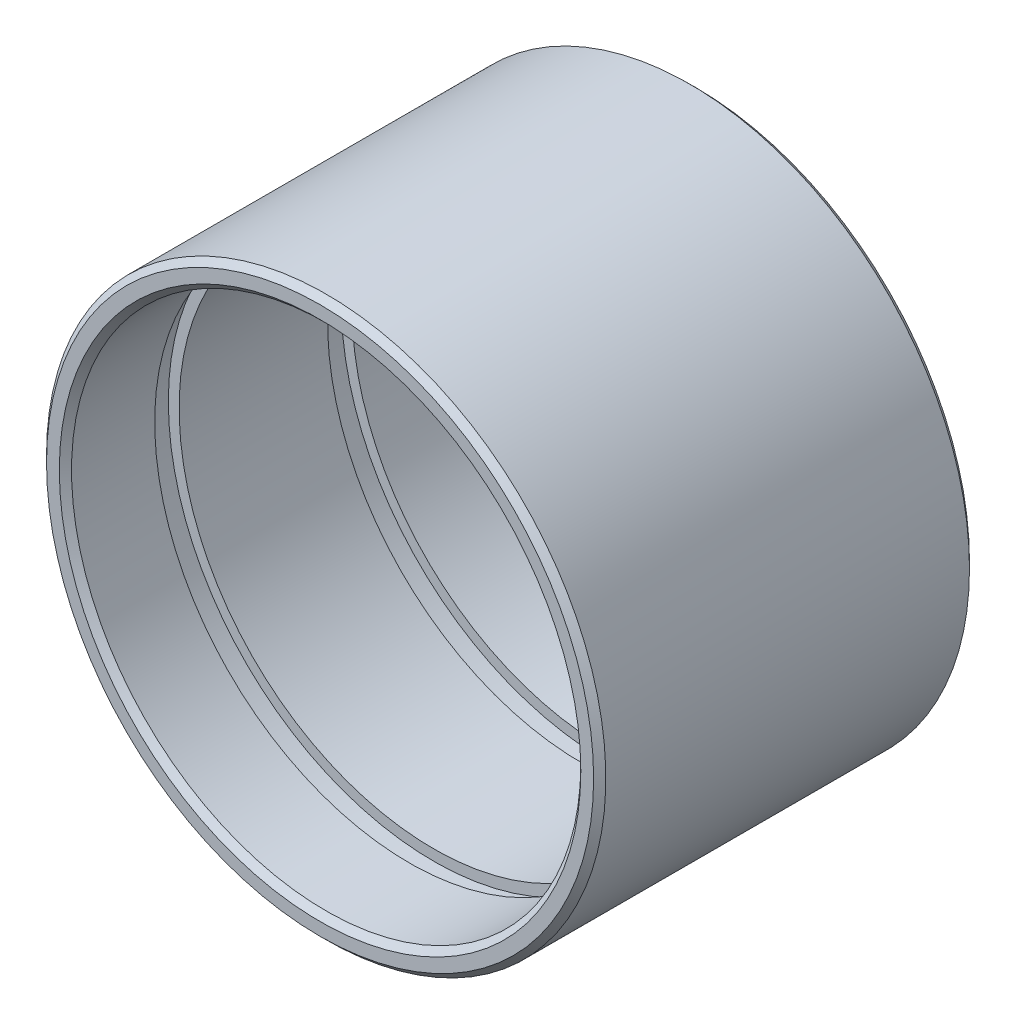
from build123d import *

# Parameters (mm, degrees)
SKETCH1_R          = 17.4625
SKETCH1_R_2        = 15.9004
BASE_EXTRUDE_DEPTH = 23.4696
SKETCH2_R          = 16.5735
CUT_EXTRUDE1_DEPTH = 1.524
CUT_EXTRUDE2_START = 1.524
SKETCH3_R          = 16.5735
CUT_EXTRUDE2_DEPTH = 1.524
CHAMFER1_SIZE      = 0.381


with BuildPart() as part:
    # Sketch1 → Base-Extrude (new body)
    with BuildSketch(Plane.XY):
        Circle(SKETCH1_R)
        Circle(SKETCH1_R_2, mode=Mode.SUBTRACT)
    extrude(amount=BASE_EXTRUDE_DEPTH)

    # Sketch2 → Cut-Extrude1 (cut)
    with BuildSketch(Plane.XY.offset(7.0993)):
        Circle(SKETCH2_R)
    extrude(amount=-CUT_EXTRUDE1_DEPTH, mode=Mode.SUBTRACT)

    # Sketch3 → Cut-Extrude2 (cut)
    with BuildSketch(Plane.XY.offset(16.3703).offset(CUT_EXTRUDE2_START)):
        Circle(SKETCH3_R)
    extrude(amount=-CUT_EXTRUDE2_DEPTH, mode=Mode.SUBTRACT)

    # Chamfer1
    chamfer1_edges = [part.edges().sort_by_distance(p)[0] for p in [
        (-17.4625, 0, 0),
        (-17.4625, 0, 23.4696),
        (-15.9004, 0, 0),
        (-15.9004, 0, 23.4696),
    ]]
    chamfer(chamfer1_edges, length=CHAMFER1_SIZE)


solid = part.part
